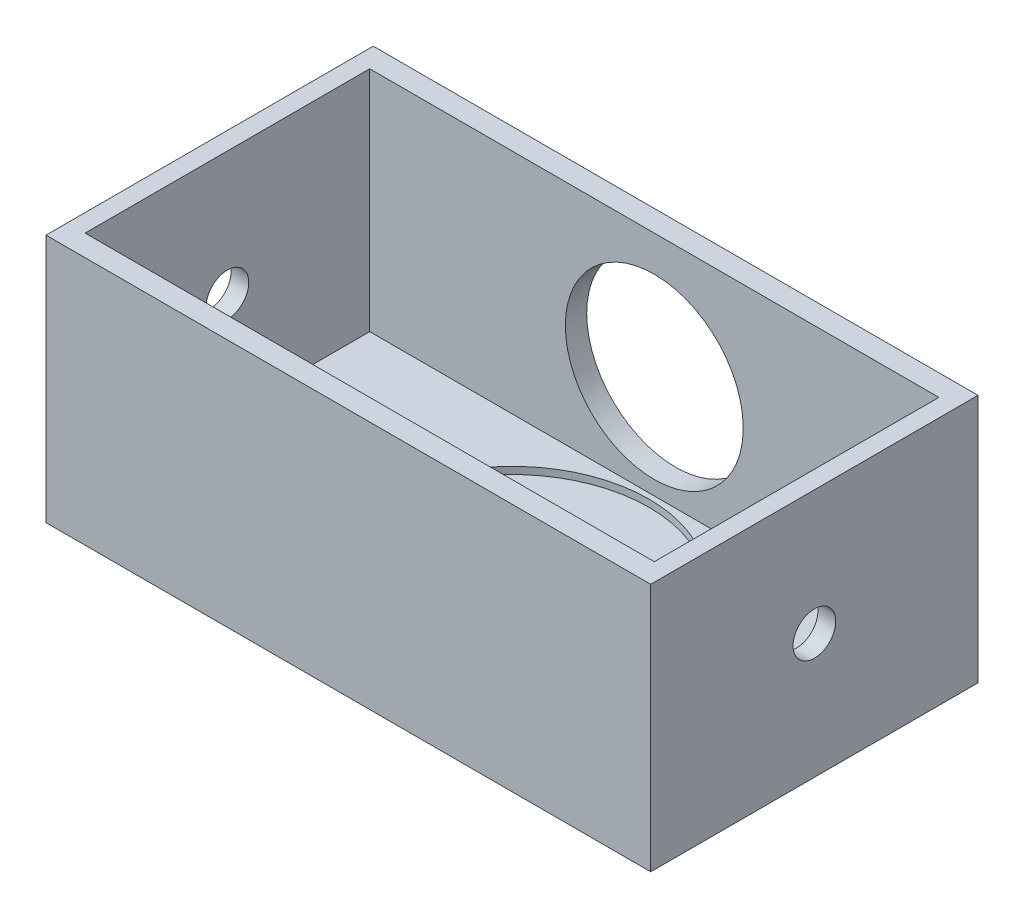
from build123d import *

# Parameters (mm, degrees)
SKETCH1_W           = 85
SKETCH1_H           = 46
BOSS_EXTRUDE1_DEPTH = 35
SKETCH3_R           = 12.5
CUT_EXTRUDE2_DEPTH  = 10
SKETCH4_R           = 3
CUT_EXTRUDE3_DEPTH  = 95.757585448
SKETCH2_W           = 80
SKETCH2_H           = 40
CUT_EXTRUDE4_DEPTH  = 60.667830529
SKETCH5_W           = 80
SKETCH5_H           = 40
BOSS_EXTRUDE2_DEPTH = 3
SKETCH6_R           = 19.25
SKETCH6_R_2         = 1.875
CUT_EXTRUDE6_DEPTH  = 1
BOSS_EXTRUDE3_START = 5
SKETCH7_R           = 1.875
BOSS_EXTRUDE3_DEPTH = 5


with BuildPart() as part:
    # Sketch1 → Boss-Extrude1 (new body)
    with BuildSketch(Plane(origin=(0, 0, 0), x_dir=(1, 0, 0), z_dir=(0, 1, 0))):
        Rectangle(SKETCH1_W, SKETCH1_H)
    extrude(amount=BOSS_EXTRUDE1_DEPTH)

    # Sketch3 → Cut-Extrude2 (cut)
    with BuildSketch(Plane(origin=(0, 0, -23), x_dir=(-1, 0, 0), z_dir=(0, 0, -1))):
        with Locations((0, 17.5)):
            Circle(SKETCH3_R)
    extrude(amount=-CUT_EXTRUDE2_DEPTH, mode=Mode.SUBTRACT)

    # Sketch4 → Cut-Extrude3 (cut, through all)
    with BuildSketch(Plane(origin=(42.5, 0, 0), x_dir=(0, 0, -1), z_dir=(1, 0, 0))):
        with Locations((0, 17.5)):
            Circle(SKETCH4_R)
    extrude(amount=-CUT_EXTRUDE3_DEPTH, mode=Mode.SUBTRACT)

    # Sketch2 → Cut-Extrude4 (cut, through all)
    with BuildSketch(Plane(origin=(0, 35, 0), x_dir=(1, 0, 0), z_dir=(0, 1, 0))):
        Rectangle(SKETCH2_W, SKETCH2_H)
    extrude(amount=-CUT_EXTRUDE4_DEPTH, mode=Mode.SUBTRACT)

    # Sketch5 → Boss-Extrude2 (add)
    with BuildSketch(Plane(origin=(0, 0, 0), x_dir=(1, 0, 0), z_dir=(0, 1, 0))):
        Rectangle(SKETCH5_W, SKETCH5_H)
    extrude(amount=BOSS_EXTRUDE2_DEPTH)

    # Sketch6 → Cut-Extrude6 (cut)
    with BuildSketch(Plane(origin=(0, 3, 0), x_dir=(1, 0, 0), z_dir=(0, 1, 0))):
        with Locations(Location((0, 0, 0), (0, 0, 270))):
            Circle(SKETCH6_R)
        with Locations(Location((0, 0, 0), (0, 0, 270))):
            Circle(SKETCH6_R_2, mode=Mode.SUBTRACT)
    extrude(amount=-CUT_EXTRUDE6_DEPTH, mode=Mode.SUBTRACT)

    # Sketch7 → Boss-Extrude3 (add)
    with BuildSketch(Plane(origin=(0, 3, 0), x_dir=(1, 0, 0), z_dir=(0, 1, 0)).offset(BOSS_EXTRUDE3_START)):
        with Locations(Location((0, 0, 0), (0, 0, 270))):
            Circle(SKETCH7_R)
    extrude(amount=-BOSS_EXTRUDE3_DEPTH)


solid = part.part
